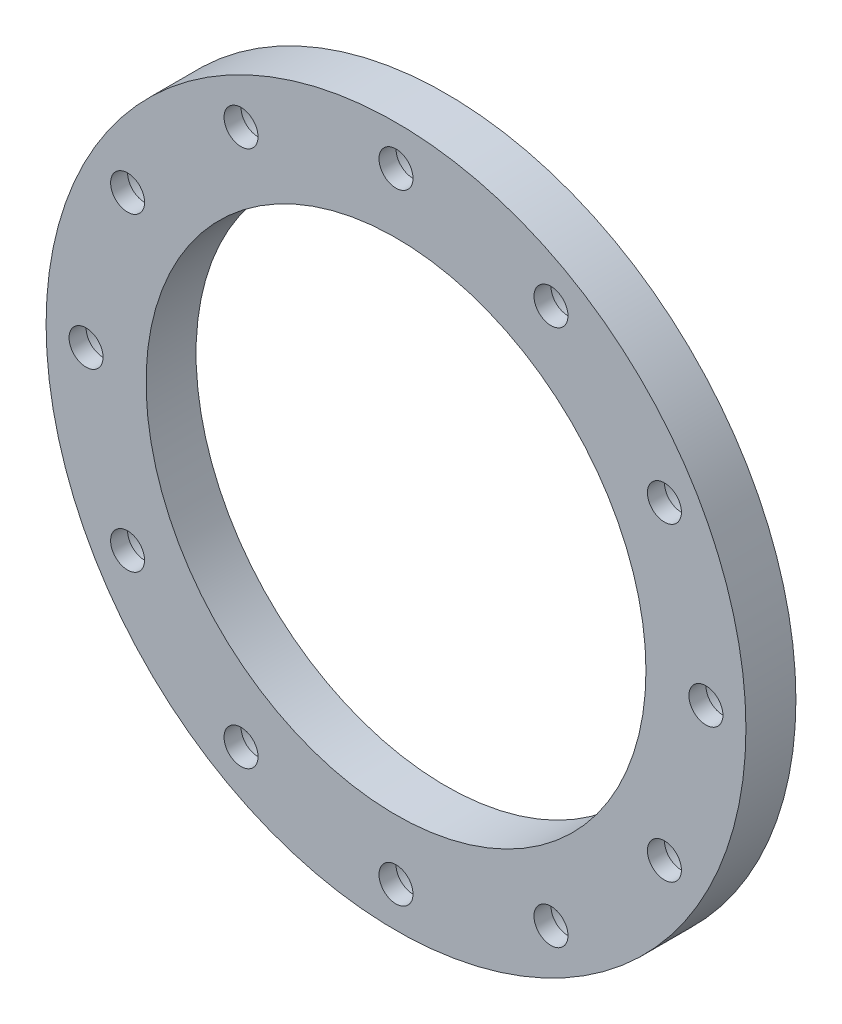
from build123d import *

# Parameters (mm, degrees)
SKETCH1_R           = 35
SKETCH1_R_2         = 25
BOSS_EXTRUDE1_DEPTH = 5
CUT_EXTRUDE1_REACH  = 51.749
SKETCH2_R           = 1.7
SKETCH3_R           = 3.3
CUT_EXTRUDE2_DEPTH  = 3.3
CIRPATTERN1_COUNT   = 12


with BuildPart() as part:
    # Sketch1 → Boss-Extrude1 (new body)
    with BuildSketch(Plane.XY):
        Circle(SKETCH1_R)
        Circle(SKETCH1_R_2, mode=Mode.SUBTRACT)
    extrude(amount=BOSS_EXTRUDE1_DEPTH)

    # Sketch2 → Cut-Extrude1 (cut, up to next)
    with BuildSketch(Plane.XY.offset(5), mode=Mode.PRIVATE) as cut_extrude1_sk1:
        with Locations((0, 31)):
            Circle(SKETCH2_R)
    cut_extrude1_tool1 = extrude(cut_extrude1_sk1.sketch, amount=-CUT_EXTRUDE1_REACH, mode=Mode.PRIVATE) & part.part
    # Sketch2 → Cut-Extrude1 (cut, up to next)
    with BuildSketch(Plane.XY.offset(5), mode=Mode.PRIVATE) as cut_extrude1_sk2:
        with Locations((15.5, 26.846787517)):
            Circle(SKETCH2_R)
    cut_extrude1_tool2 = extrude(cut_extrude1_sk2.sketch, amount=-CUT_EXTRUDE1_REACH, mode=Mode.PRIVATE) & part.part
    # Sketch2 → Cut-Extrude1 (cut, up to next)
    with BuildSketch(Plane.XY.offset(5), mode=Mode.PRIVATE) as cut_extrude1_sk3:
        with Locations((26.846787517, 15.5)):
            Circle(SKETCH2_R)
    cut_extrude1_tool3 = extrude(cut_extrude1_sk3.sketch, amount=-CUT_EXTRUDE1_REACH, mode=Mode.PRIVATE) & part.part
    # Sketch2 → Cut-Extrude1 (cut, up to next)
    with BuildSketch(Plane.XY.offset(5), mode=Mode.PRIVATE) as cut_extrude1_sk4:
        with Locations((31, 0)):
            Circle(SKETCH2_R)
    cut_extrude1_tool4 = extrude(cut_extrude1_sk4.sketch, amount=-CUT_EXTRUDE1_REACH, mode=Mode.PRIVATE) & part.part
    # Sketch2 → Cut-Extrude1 (cut, up to next)
    with BuildSketch(Plane.XY.offset(5), mode=Mode.PRIVATE) as cut_extrude1_sk5:
        with Locations((26.846787517, -15.5)):
            Circle(SKETCH2_R)
    cut_extrude1_tool5 = extrude(cut_extrude1_sk5.sketch, amount=-CUT_EXTRUDE1_REACH, mode=Mode.PRIVATE) & part.part
    # Sketch2 → Cut-Extrude1 (cut, up to next)
    with BuildSketch(Plane.XY.offset(5), mode=Mode.PRIVATE) as cut_extrude1_sk6:
        with Locations((15.5, -26.846787517)):
            Circle(SKETCH2_R)
    cut_extrude1_tool6 = extrude(cut_extrude1_sk6.sketch, amount=-CUT_EXTRUDE1_REACH, mode=Mode.PRIVATE) & part.part
    # Sketch2 → Cut-Extrude1 (cut, up to next)
    with BuildSketch(Plane.XY.offset(5), mode=Mode.PRIVATE) as cut_extrude1_sk7:
        with Locations((0, -31)):
            Circle(SKETCH2_R)
    cut_extrude1_tool7 = extrude(cut_extrude1_sk7.sketch, amount=-CUT_EXTRUDE1_REACH, mode=Mode.PRIVATE) & part.part
    # Sketch2 → Cut-Extrude1 (cut, up to next)
    with BuildSketch(Plane.XY.offset(5), mode=Mode.PRIVATE) as cut_extrude1_sk8:
        with Locations((-15.5, -26.846787517)):
            Circle(SKETCH2_R)
    cut_extrude1_tool8 = extrude(cut_extrude1_sk8.sketch, amount=-CUT_EXTRUDE1_REACH, mode=Mode.PRIVATE) & part.part
    # Sketch2 → Cut-Extrude1 (cut, up to next)
    with BuildSketch(Plane.XY.offset(5), mode=Mode.PRIVATE) as cut_extrude1_sk9:
        with Locations((-26.846787517, -15.5)):
            Circle(SKETCH2_R)
    cut_extrude1_tool9 = extrude(cut_extrude1_sk9.sketch, amount=-CUT_EXTRUDE1_REACH, mode=Mode.PRIVATE) & part.part
    # Sketch2 → Cut-Extrude1 (cut, up to next)
    with BuildSketch(Plane.XY.offset(5), mode=Mode.PRIVATE) as cut_extrude1_sk10:
        with Locations((-31, 0)):
            Circle(SKETCH2_R)
    cut_extrude1_tool10 = extrude(cut_extrude1_sk10.sketch, amount=-CUT_EXTRUDE1_REACH, mode=Mode.PRIVATE) & part.part
    # Sketch2 → Cut-Extrude1 (cut, up to next)
    with BuildSketch(Plane.XY.offset(5), mode=Mode.PRIVATE) as cut_extrude1_sk11:
        with Locations((-26.846787517, 15.5)):
            Circle(SKETCH2_R)
    cut_extrude1_tool11 = extrude(cut_extrude1_sk11.sketch, amount=-CUT_EXTRUDE1_REACH, mode=Mode.PRIVATE) & part.part
    # Sketch2 → Cut-Extrude1 (cut, up to next)
    with BuildSketch(Plane.XY.offset(5), mode=Mode.PRIVATE) as cut_extrude1_sk12:
        with Locations((-15.5, 26.846787517)):
            Circle(SKETCH2_R)
    cut_extrude1_tool12 = extrude(cut_extrude1_sk12.sketch, amount=-CUT_EXTRUDE1_REACH, mode=Mode.PRIVATE) & part.part
    add(cut_extrude1_tool1.solids().sort_by_distance((0, 31, 5))[0], mode=Mode.SUBTRACT)
    add(cut_extrude1_tool2.solids().sort_by_distance((15.5, 26.846788, 5))[0], mode=Mode.SUBTRACT)
    add(cut_extrude1_tool3.solids().sort_by_distance((26.846788, 15.5, 5))[0], mode=Mode.SUBTRACT)
    add(cut_extrude1_tool4.solids().sort_by_distance((31, 0, 5))[0], mode=Mode.SUBTRACT)
    add(cut_extrude1_tool5.solids().sort_by_distance((26.846788, -15.5, 5))[0], mode=Mode.SUBTRACT)
    add(cut_extrude1_tool6.solids().sort_by_distance((15.5, -26.846788, 5))[0], mode=Mode.SUBTRACT)
    add(cut_extrude1_tool7.solids().sort_by_distance((0, -31, 5))[0], mode=Mode.SUBTRACT)
    add(cut_extrude1_tool8.solids().sort_by_distance((-15.5, -26.846788, 5))[0], mode=Mode.SUBTRACT)
    add(cut_extrude1_tool9.solids().sort_by_distance((-26.846788, -15.5, 5))[0], mode=Mode.SUBTRACT)
    add(cut_extrude1_tool10.solids().sort_by_distance((-31, 0, 5))[0], mode=Mode.SUBTRACT)
    add(cut_extrude1_tool11.solids().sort_by_distance((-26.846788, 15.5, 5))[0], mode=Mode.SUBTRACT)
    add(cut_extrude1_tool12.solids().sort_by_distance((-15.5, 26.846788, 5))[0], mode=Mode.SUBTRACT)

    # Sketch3 → Cut-Extrude2 (cut)
    with BuildSketch(Plane(origin=(0, 0, 0), x_dir=(-1, 0, 0), z_dir=(0, 0, -1))):
        with Locations((0, 31)):
            Circle(SKETCH3_R)
    cut_extrude2 = extrude(amount=-CUT_EXTRUDE2_DEPTH, mode=Mode.SUBTRACT)

    # CirPattern1: Cut-Extrude2 ×12 about axis
    cirpattern1_axis = Axis((0, 0, 0), (0, 0, 1))
    for i in range(1, CIRPATTERN1_COUNT):
        add(cut_extrude2.rotate(cirpattern1_axis, i * 360 / CIRPATTERN1_COUNT), mode=Mode.SUBTRACT)


solid = part.part
